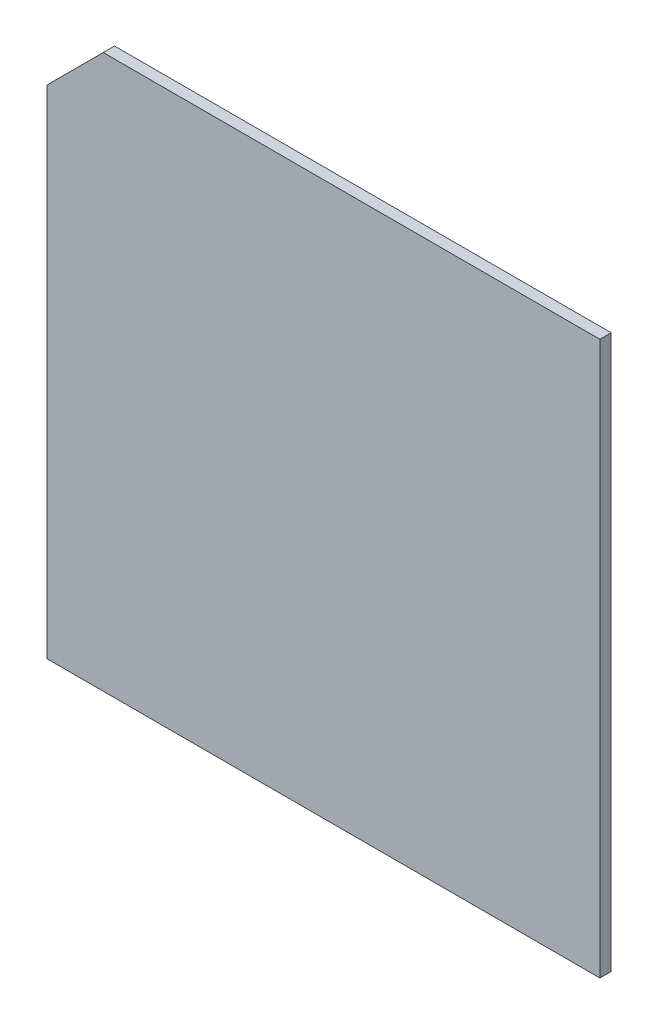
from build123d import *

# Parameters (mm, degrees)
BOSS_EXTRUDE1_DEPTH = 1


with BuildPart() as part:
    # Sketch1 → Boss-Extrude1 (new body)
    with BuildSketch(Plane(origin=(0, 0, 0), x_dir=(0, 1, 0), z_dir=(0, 0, 1))):
        Polygon((44, 49), (49, 44), (49, 0), (0, 0), (0, 49), align=None)
    extrude(amount=BOSS_EXTRUDE1_DEPTH)


solid = part.part
